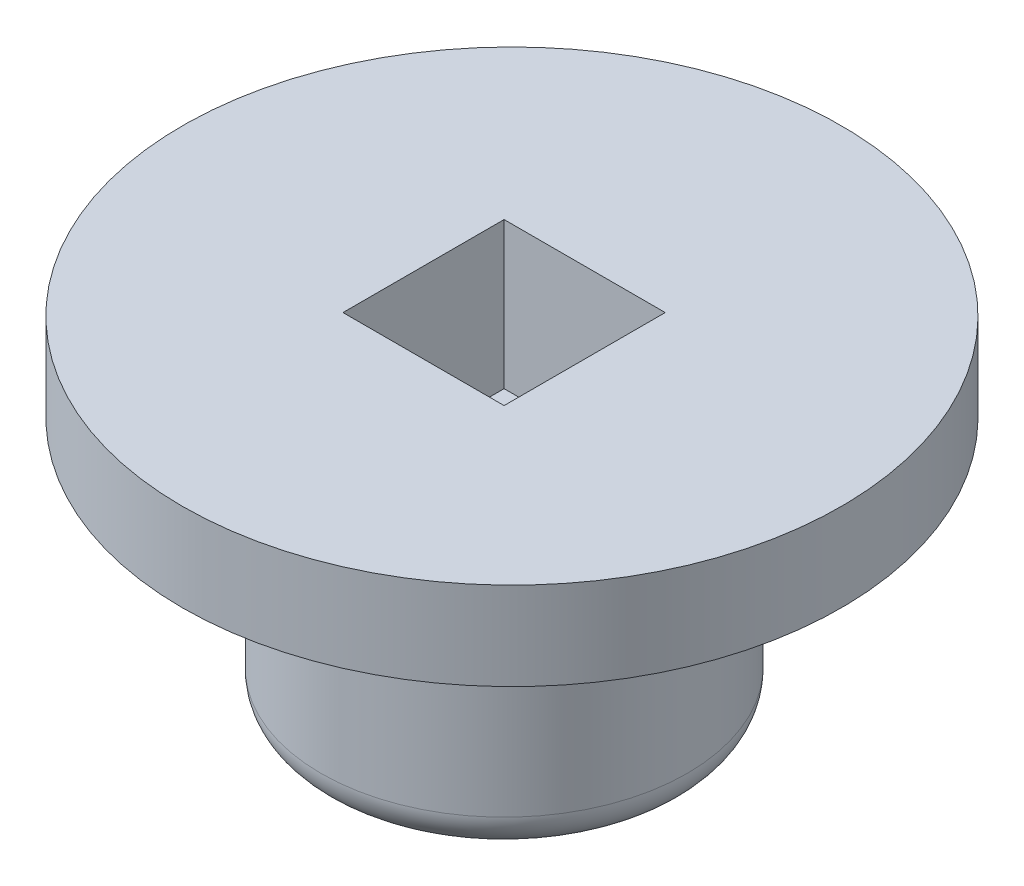
from build123d import *

# Parameters (mm, degrees)
SKETCH_1_R          = 2.5
EXTRUDE_1_DEPTH     = 3.5
SKETCH_2_R          = 4.5
EXTRUDE_2_DEPTH     = 1.2
SKETCH_4_W          = 2.2
SKETCH_4_H          = 2.2
CUT_EXTRUDE_1_DEPTH = 2
FILLET_1_R          = 0.5


with BuildPart() as part:
    # 草图1 → 凸台-拉伸1 (new body)
    with BuildSketch(Plane(origin=(0, 0, 0), x_dir=(1, 0, 0), z_dir=(0, 1, 0))):
        with Locations(Location((0, 0, 0), (0, 0, 270))):
            Circle(SKETCH_1_R)
    extrude(amount=EXTRUDE_1_DEPTH)

    # 草图2 → 凸台-拉伸2 (add)
    with BuildSketch(Plane(origin=(0, 3.5, 0), x_dir=(1, 0, 0), z_dir=(0, 1, 0))):
        with Locations(Location((0.094879954, 0.012027373, 0), (0, 0, 270))):
            Circle(SKETCH_2_R)
    extrude(amount=EXTRUDE_2_DEPTH)

    # 草图4 → 切除-拉伸1 (cut)
    with BuildSketch(Plane(origin=(0, 4.7, 0), x_dir=(1, 0, 0), z_dir=(0, 1, 0))):
        Rectangle(SKETCH_4_W, SKETCH_4_H)
    extrude(amount=-CUT_EXTRUDE_1_DEPTH, mode=Mode.SUBTRACT)

    # 圆角1
    fillet_1_edges = [part.edges().sort_by_distance(p)[0] for p in [
        (0, 0, -2.5),
    ]]
    fillet(fillet_1_edges, radius=FILLET_1_R)


solid = part.part
